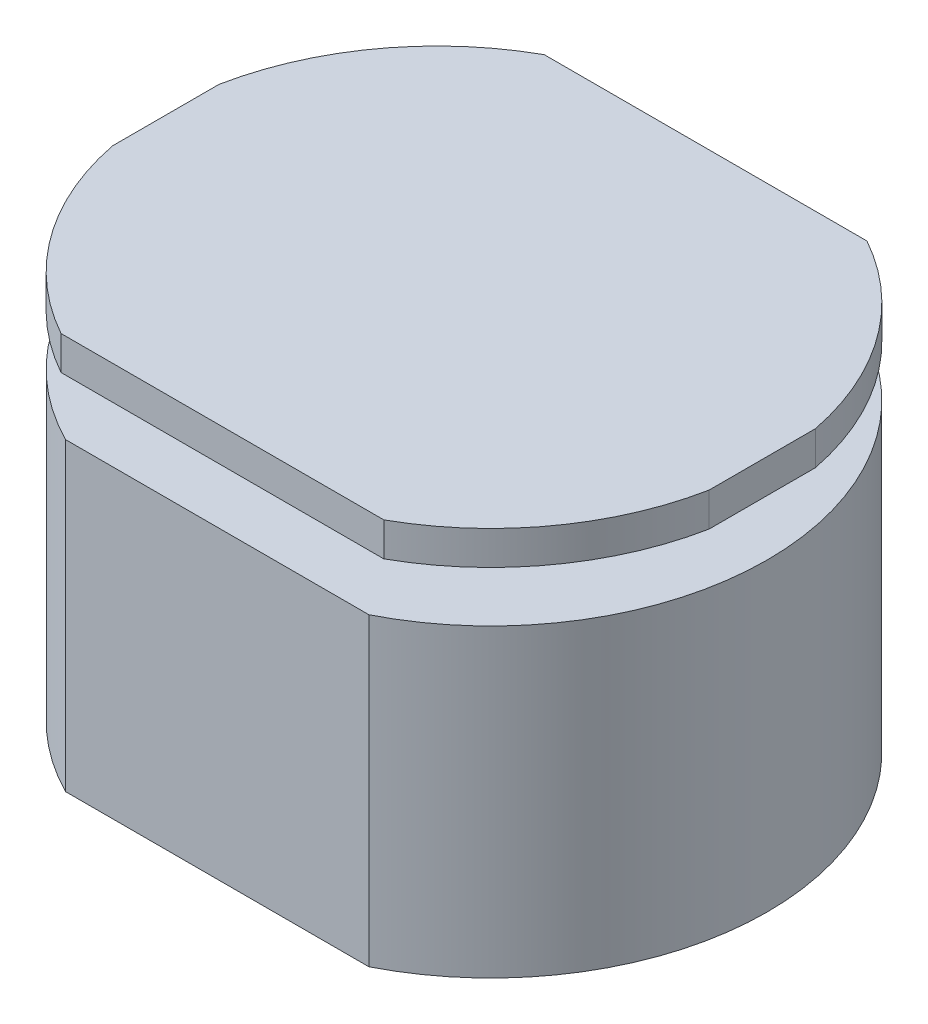
from build123d import *

# Parameters (mm, degrees)
ESBO_O1_W                = 589
ESBO_O1_H                = 479
RESSALTO_EXTRUS_O1_DEPTH = 296
ESBO_O2_W                = 220
ESBO_O2_H                = 180
RESSALTO_EXTRUS_O2_DEPTH = 49.2
ESBO_O3_W                = 579
ESBO_O3_H                = 469
RESSALTO_EXTRUS_O3_DEPTH = 32.8
CORTE_EXTRUS_O1_REACH    = 537.7


with BuildPart() as part:
    # Esboço1 → Ressalto-extrusão1 (new body)
    with BuildSketch(Plane(origin=(0, 0, 0), x_dir=(1, 0, 0), z_dir=(0, 1, 0))):
        Rectangle(ESBO_O1_W, ESBO_O1_H)
    extrude(amount=RESSALTO_EXTRUS_O1_DEPTH)

    # Esboço2 → Ressalto-extrusão2 (add)
    with BuildSketch(Plane(origin=(0, 296, 0), x_dir=(1, 0, 0), z_dir=(0, 1, 0))):
        Rectangle(ESBO_O2_W, ESBO_O2_H)
    extrude(amount=RESSALTO_EXTRUS_O2_DEPTH)

    # Esboço3 → Ressalto-extrusão3 (add)
    with BuildSketch(Plane(origin=(0, 345.2, 0), x_dir=(1, 0, 0), z_dir=(0, 1, 0))):
        Rectangle(ESBO_O3_W, ESBO_O3_H)
    extrude(amount=RESSALTO_EXTRUS_O3_DEPTH)

    # Corte-extrusão1: up to this face of the body (flat: up to its plane)
    corte_extrus_o1_end = Plane(part.part.faces().sort_by_distance((0, 0, 0))[0])
    # Esboço4 → Corte-extrusão1 (cut, up to the picked face)
    with BuildSketch(Plane(origin=(0, 378, 0), x_dir=(1, 0, 0), z_dir=(0, 1, 0)), mode=Mode.PRIVATE) as corte_extrus_o1_sk1:
        with BuildLine():
            ThreePointArc((-156.665637301, -234.5), (-243.283458342, -157.700862236), (-289.5, -51.565167202))
            Line((-289.5, -51.565167202), (-289.5, -234.5))
            Line((-289.5, -234.5), (-156.665637301, -234.5))
        make_face()
    corte_extrus_o1_tool1 = split(extrude(corte_extrus_o1_sk1.sketch, amount=-CORTE_EXTRUS_O1_REACH, mode=Mode.PRIVATE), bisect_by=corte_extrus_o1_end, keep=Keep.BOTH, mode=Mode.PRIVATE)
    # Esboço4 → Corte-extrusão1 (cut, up to the picked face)
    with BuildSketch(Plane(origin=(0, 378, 0), x_dir=(1, 0, 0), z_dir=(0, 1, 0)), mode=Mode.PRIVATE) as corte_extrus_o1_sk2:
        with BuildLine():
            ThreePointArc((-289.5, 51.565167202), (-243.283458342, 157.700862236), (-156.665637301, 234.5))
            Line((-156.665637301, 234.5), (-289.5, 234.5))
            Line((-289.5, 234.5), (-289.5, 51.565167202))
        make_face()
    corte_extrus_o1_tool2 = split(extrude(corte_extrus_o1_sk2.sketch, amount=-CORTE_EXTRUS_O1_REACH, mode=Mode.PRIVATE), bisect_by=corte_extrus_o1_end, keep=Keep.BOTH, mode=Mode.PRIVATE)
    # Esboço4 → Corte-extrusão1 (cut, up to the picked face)
    with BuildSketch(Plane(origin=(0, 378, 0), x_dir=(1, 0, 0), z_dir=(0, 1, 0)), mode=Mode.PRIVATE) as corte_extrus_o1_sk3:
        with BuildLine():
            Line((289.5, 234.5), (156.665637301, 234.5))
            ThreePointArc((156.665637301, 234.5), (243.283458342, 157.700862236), (289.5, 51.565167202))
            Line((289.5, 51.565167202), (289.5, 234.5))
        make_face()
    corte_extrus_o1_tool3 = split(extrude(corte_extrus_o1_sk3.sketch, amount=-CORTE_EXTRUS_O1_REACH, mode=Mode.PRIVATE), bisect_by=corte_extrus_o1_end, keep=Keep.BOTH, mode=Mode.PRIVATE)
    # Esboço4 → Corte-extrusão1 (cut, up to the picked face)
    with BuildSketch(Plane(origin=(0, 378, 0), x_dir=(1, 0, 0), z_dir=(0, 1, 0)), mode=Mode.PRIVATE) as corte_extrus_o1_sk4:
        with BuildLine():
            Line((289.5, -234.5), (289.5, -51.565167202))
            ThreePointArc((289.5, -51.565167202), (243.283458342, -157.700862236), (156.665637301, -234.5))
            Line((156.665637301, -234.5), (289.5, -234.5))
        make_face()
    corte_extrus_o1_tool4 = split(extrude(corte_extrus_o1_sk4.sketch, amount=-CORTE_EXTRUS_O1_REACH, mode=Mode.PRIVATE), bisect_by=corte_extrus_o1_end, keep=Keep.BOTH, mode=Mode.PRIVATE)
    # Esboço4 → Corte-extrusão1 (cut, up to the picked face)
    with BuildSketch(Plane(origin=(0, 378, 0), x_dir=(1, 0, 0), z_dir=(0, 1, 0)), mode=Mode.PRIVATE) as corte_extrus_o1_sk5:
        with BuildLine():
            ThreePointArc((147.25, 239.5), (151.982646469, 237.046753946), (156.665637301, 234.5))
            Line((156.665637301, 234.5), (289.5, 234.5))
            Line((289.5, 234.5), (289.5, 51.565167202))
            ThreePointArc((289.5, 51.565167202), (293.247075515, 25.903506357), (294.5, 9.48e-07))
            Line((294.5, 9.48e-07), (294.5, 239.5))
            Line((294.5, 239.5), (147.25, 239.5))
        make_face()
    corte_extrus_o1_tool5 = split(extrude(corte_extrus_o1_sk5.sketch, amount=-CORTE_EXTRUS_O1_REACH, mode=Mode.PRIVATE), bisect_by=corte_extrus_o1_end, keep=Keep.BOTH, mode=Mode.PRIVATE)
    # Esboço4 → Corte-extrusão1 (cut, up to the picked face)
    with BuildSketch(Plane(origin=(0, 378, 0), x_dir=(1, 0, 0), z_dir=(0, 1, 0)), mode=Mode.PRIVATE) as corte_extrus_o1_sk6:
        with BuildLine():
            Line((294.5, -239.5), (294.5, 9.48e-07))
            ThreePointArc((294.5, 9.48e-07), (293.247075606, -25.903505414), (289.5, -51.565167202))
            Line((289.5, -51.565167202), (289.5, -234.5))
            Line((289.5, -234.5), (156.665637301, -234.5))
            ThreePointArc((156.665637301, -234.5), (151.982646469, -237.046753946), (147.25, -239.5))
            Line((147.25, -239.5), (294.5, -239.5))
        make_face()
    corte_extrus_o1_tool6 = split(extrude(corte_extrus_o1_sk6.sketch, amount=-CORTE_EXTRUS_O1_REACH, mode=Mode.PRIVATE), bisect_by=corte_extrus_o1_end, keep=Keep.BOTH, mode=Mode.PRIVATE)
    # Esboço4 → Corte-extrusão1 (cut, up to the picked face)
    with BuildSketch(Plane(origin=(0, 378, 0), x_dir=(1, 0, 0), z_dir=(0, 1, 0)), mode=Mode.PRIVATE) as corte_extrus_o1_sk7:
        with BuildLine():
            ThreePointArc((-289.5, -51.565167202), (-293.24707556, -25.903505885), (-294.5, 0))
            Line((-294.5, 0), (-294.5, -239.5))
            Line((-294.5, -239.5), (-147.25, -239.5))
            ThreePointArc((-147.25, -239.5), (-151.982646469, -237.046753946), (-156.665637301, -234.5))
            Line((-156.665637301, -234.5), (-289.5, -234.5))
            Line((-289.5, -234.5), (-289.5, -51.565167202))
        make_face()
    corte_extrus_o1_tool7 = split(extrude(corte_extrus_o1_sk7.sketch, amount=-CORTE_EXTRUS_O1_REACH, mode=Mode.PRIVATE), bisect_by=corte_extrus_o1_end, keep=Keep.BOTH, mode=Mode.PRIVATE)
    # Esboço4 → Corte-extrusão1 (cut, up to the picked face)
    with BuildSketch(Plane(origin=(0, 378, 0), x_dir=(1, 0, 0), z_dir=(0, 1, 0)), mode=Mode.PRIVATE) as corte_extrus_o1_sk8:
        with BuildLine():
            ThreePointArc((-156.665637301, 234.5), (-151.982646469, 237.046753946), (-147.25, 239.5))
            Line((-147.25, 239.5), (-294.5, 239.5))
            Line((-294.5, 239.5), (-294.5, 0))
            ThreePointArc((-294.5, 0), (-293.24707556, 25.903505885), (-289.5, 51.565167202))
            Line((-289.5, 51.565167202), (-289.5, 234.5))
            Line((-289.5, 234.5), (-156.665637301, 234.5))
        make_face()
    corte_extrus_o1_tool8 = split(extrude(corte_extrus_o1_sk8.sketch, amount=-CORTE_EXTRUS_O1_REACH, mode=Mode.PRIVATE), bisect_by=corte_extrus_o1_end, keep=Keep.BOTH, mode=Mode.PRIVATE)
    add(corte_extrus_o1_tool1.solids().sort_by(Axis((-251.602427, 378, 184.711706), (0, -1, 0)))[0], mode=Mode.SUBTRACT)
    add(corte_extrus_o1_tool2.solids().sort_by(Axis((-251.602427, 378, -184.711706), (0, -1, 0)))[0], mode=Mode.SUBTRACT)
    add(corte_extrus_o1_tool3.solids().sort_by(Axis((251.602427, 378, -184.711706), (0, -1, 0)))[0], mode=Mode.SUBTRACT)
    add(corte_extrus_o1_tool4.solids().sort_by(Axis((251.602427, 378, 184.711706), (0, -1, 0)))[0], mode=Mode.SUBTRACT)
    add(corte_extrus_o1_tool5.solids().sort_by(Axis((152.114505, 378, -237.29506), (0, -1, 0)))[0], mode=Mode.SUBTRACT)
    add(corte_extrus_o1_tool6.solids().sort_by(Axis((220.875, 378, 236.688545), (0, -1, 0)))[0], mode=Mode.SUBTRACT)
    add(corte_extrus_o1_tool7.solids().sort_by(Axis((-293.526909, 378, 25.93064), (0, -1, 0)))[0], mode=Mode.SUBTRACT)
    add(corte_extrus_o1_tool8.solids().sort_by(Axis((-292.311455, 378, -143.032584), (0, -1, 0)))[0], mode=Mode.SUBTRACT)


solid = part.part
